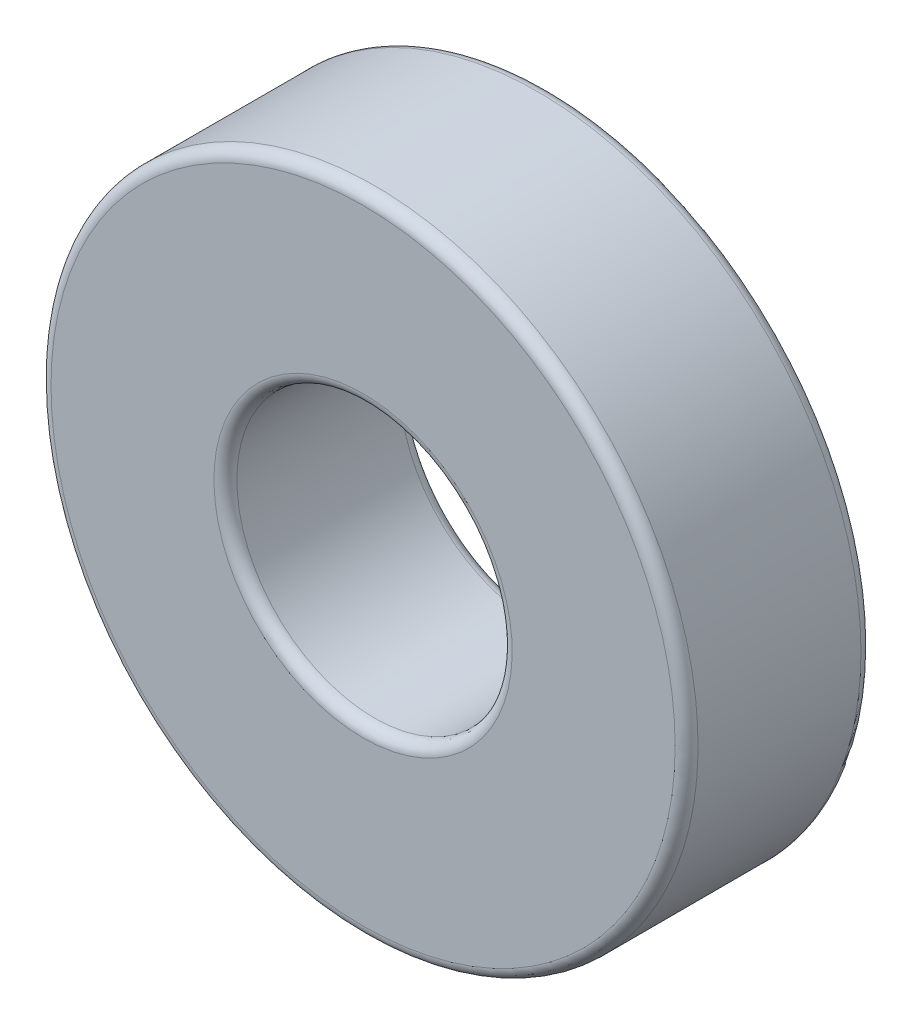
from build123d import *

# Parameters (mm, degrees)
SKETCH1_R           = 14.1
SKETCH1_R_2         = 6
BOSS_EXTRUDE1_DEPTH = 8.1
FILLET1_R           = 0.5


with BuildPart() as part:
    # Sketch1 → Boss-Extrude1 (new body)
    with BuildSketch(Plane.XY):
        with Locations(Location((1.959493634, 6.335e-06, 0), (0, 0, 270))):
            Circle(SKETCH1_R)
        with Locations(Location((1.959493634, 6.335e-06, 0), (0, 0, 270))):
            Circle(SKETCH1_R_2, mode=Mode.SUBTRACT)
    extrude(amount=BOSS_EXTRUDE1_DEPTH)

    # Fillet1
    fillet1_edges = [part.edges().sort_by_distance(p)[0] for p in [
        (1.959493634, 14.100006335, 8.1),
        (1.959493634, 14.100006335, 0),
        (1.959493634, 6.000006335, 0),
        (1.959493634, 6.000006335, 8.1),
    ]]
    fillet(fillet1_edges, radius=FILLET1_R)


solid = part.part
